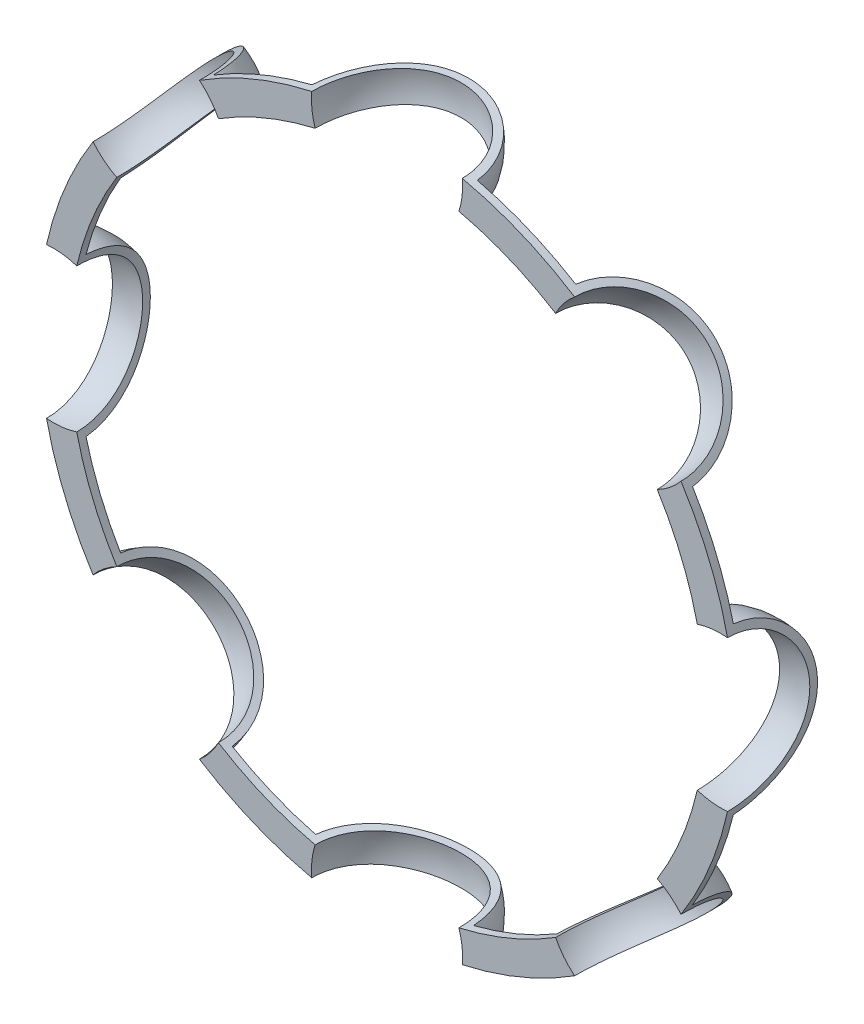
from build123d import *
from build123d.topology import SkipClean

# Parameters (mm, degrees)
BOSS_EXTRUDE1_DEPTH     = 25.4
CUT_EXTRUDE2_DEPTH      = 2171.176951311
CUT_EXTRUDE2_DEPTH_BACK = 2171.176951311
SKETCH7_W               = 3559.050660074
SKETCH7_H               = 3495.382490842
SKETCH7_R               = 1171.956
SKETCH7_R_2             = 1070.356


with BuildPart() as part:
    # Sketch1 → Boss-Extrude1 (new body)
    with BuildSketch(Plane.XY):
        with BuildLine():
            Line((0, 0), (1407.992407547, 583.209550924))
            ThreePointArc((1407.992407547, 583.209550924), (1524, 0), (1407.992407547, -583.209550924))
            Line((1407.992407547, -583.209550924), (0, 0))
        make_face()
    extrude(amount=BOSS_EXTRUDE1_DEPTH)

    # Sketch4 → Revolve5 (revolve)
    with BuildSketch(Plane(origin=(0, 0, 0), x_dir=(1, 0, 0), z_dir=(0, 1, 0))):
        with BuildLine():
            Line((1121.156, -25.4), (1400.556, -25.4))
            ThreePointArc((1400.556, -25.4), (1318.721634664, 172.165634664), (1121.156, 254))
            Line((1121.156, 254), (1121.156, -25.4))
        make_face()
    revolve(axis=Axis((1121.156, 0, 25.4), (0, 0, -1)))

    # Sketch6 → Cut-Revolve1 (revolve, cut)
    with BuildSketch(Plane(origin=(0, 0, 0), x_dir=(1, 0, 0), z_dir=(0, 1, 0))):
        with BuildLine():
            Line((1121.156, 228.595592483), (1121.156, -25.4))
            Line((1121.156, -25.4), (1375.151592483, -25.4))
            ThreePointArc((1375.151592483, -25.4), (1300.758005836, 154.202005836), (1121.156, 228.595592483))
        make_face()
    revolve(axis=Axis((1121.156, 0, 25.4), (0, 0, -1)), mode=Mode.SUBTRACT)

    # Mirror1: part across plane


with BuildPart() as part_1:
    add(part.part)
    add(part.part.mirror(Plane(origin=(0, 0, 25.4), x_dir=(0, 0, 1), z_dir=(-0.3826834323650773, 0.923879532511292, 0))))

    # Mirror2: part across plane


with BuildPart() as part_2:
    with SkipClean():  # the faces are left unmerged after this step: merging them gives an invalid solid
        add(part_1.part)
        add(part_1.part.mirror(Plane(origin=(0, 0, 25.4), x_dir=(0, 0, 1), z_dir=(0.9238795325112712, -0.38268343236512725, 0))))

    # Mirror3: part across plane


with BuildPart() as part_3:
    with SkipClean():  # the faces are left unmerged after this step: merging them gives an invalid solid
        add(part_2.part)
        add(part_2.part.mirror(Plane(origin=(0, 0, 25.4), x_dir=(0, 0, 1), z_dir=(0.3826834323650773, 0.923879532511292, 0))))

    # Sketch7 → Cut-Extrude2 (cut, two sides: drawn at the far end of the back side and taken through both)
    # profile 1 of 2: a face of its own
    with BuildSketch(Plane.XY.offset(-CUT_EXTRUDE2_DEPTH_BACK)):
        Rectangle(SKETCH7_W, SKETCH7_H)
        Circle(SKETCH7_R, mode=Mode.SUBTRACT)
    # profile 2 of 2: a face of its own
    with BuildSketch(Plane.XY.offset(-CUT_EXTRUDE2_DEPTH_BACK)):
        with Locations(Location((0, 0, 0), (0, 0, 13.044436457))):
            Circle(SKETCH7_R_2)
    extrude(amount=CUT_EXTRUDE2_DEPTH + CUT_EXTRUDE2_DEPTH_BACK, mode=Mode.SUBTRACT)


solid = part_3.part
